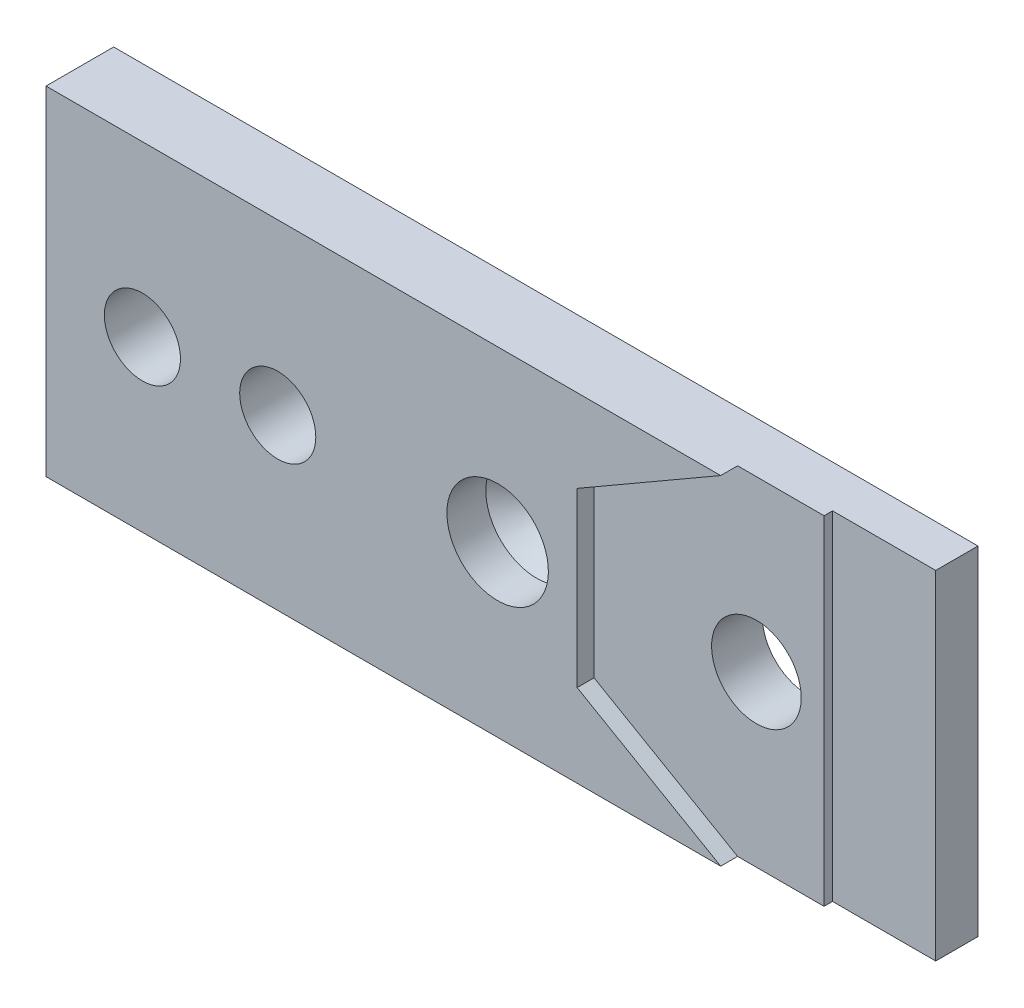
from build123d import *

# Parameters (mm, degrees)
AUFSATZ_LINEAR_AUSTRAGEN1_DEPTH    = 20
SKIZZE2_R                          = 1.6499999999999988
SKIZZE2_R_2                        = 2.65
SKIZZE2_R_3                        = 2.250000000000001
SCHNITT_LINEAR_AUSTRAGEN1_DEPTH    = 3
SKIZZE3_R                          = 2.250000000000001
SKIZZE3_R_2                        = 1.6499999999999988
AUFSATZ_LINEAR_AUSTRAGEN2_DEPTH    = 1
SKIZZE5_W                          = 1.9999999999999998
SKIZZE5_H                          = 2
SCHNITT_LINEAR_AUSTRAGEN2_DEPTH    = 1
K_RPER_VERSCHIEBEN_KOPIEREN1_ANGLE = 90.00000000007478


with BuildPart() as part:
    # Skizze1 → Aufsatz-Linear austragen1 (new body)
    with BuildSketch(Plane.XY):
        Polygon((0, 0), (51.099999999999994, 0), (51.1, 2.5), (45, 2.499999999999999), (45, 3.0000000000000058), (6e-16, 3), align=None)
    extrude(amount=AUFSATZ_LINEAR_AUSTRAGEN1_DEPTH)

    # Skizze2 → Schnitt-Linear austragen1 (cut)
    with BuildSketch(Plane.XZ):
        with Locations(Location((26.699999999999996, 9.999999999999998, 0), (0, 0, 270))):
            Circle(SKIZZE2_R)
        with Locations(Location((40.99999999999999, 10, 0), (0, 0, 270))):
            Circle(SKIZZE2_R_2)
        with Locations(Location((13.699999999999996, 10, 0), (0, 0, 270))):
            Circle(SKIZZE2_R_3)
        with Locations(Location((5.699999999999995, 9.999999999999998, 0), (0, 0, 270))):
            Circle(SKIZZE2_R_3)
    extrude(amount=-SCHNITT_LINEAR_AUSTRAGEN1_DEPTH, mode=Mode.SUBTRACT)

    # Skizze3 → Aufsatz-Linear austragen2 (add)
    with BuildSketch(Plane(origin=(-3.8e-16, 3, 0), x_dir=(1, 1.2e-16, 0), z_dir=(-1.2e-16, 1, 0))):
        Polygon((39.887048957087536, 0), (9.5e-16, 0), (9.5e-16, -8), (-1.9999999999999987, -8), (-1.9999999999999987, -10), (9.5e-16, -10), (9.5e-16, -20), (39.887048957087536, -19.99999999999999), (31.39999999999999, -15.1), (31.39999999999999, -4.900000000000001), align=None)
        with Locations((5.699999999999995, -9.999999999999998)):
            Circle(SKIZZE3_R, mode=Mode.SUBTRACT)
        with Locations((13.699999999999996, -10)):
            Circle(SKIZZE3_R, mode=Mode.SUBTRACT)
        with Locations((26.699999999999996, -9.999999999999998)):
            Circle(SKIZZE3_R_2, mode=Mode.SUBTRACT)
    extrude(amount=AUFSATZ_LINEAR_AUSTRAGEN2_DEPTH)

    # Skizze4 → Schnitt-Rotation3 (revolve, cut)
    with BuildSketch(Plane.XY.offset(10), mode=Mode.PRIVATE) as schnitt_rotation3_sk:
        Polygon((23.699999999999996, 3.9999999999999964), (23.699999999999996, 1.699999999999991), (25.199999999999992, 0.2), (26.699999999999996, 0.2000000000000001), (26.699999999999996, 3.9999999999999964), align=None)
    revolve(schnitt_rotation3_sk.sketch.rotate(Axis((26.699999999999996, 0.2000000000000001, 10), (0, 1, 0)), 270), axis=Axis((26.699999999999996, 0.2000000000000001, 10), (0, 1, 0)), mode=Mode.SUBTRACT)

    # Skizze5 → Schnitt-Linear austragen2 (cut)
    with BuildSketch(Plane(origin=(0, 4, 0), x_dir=(1, 0, 0), z_dir=(0, 1, 0))):
        with Locations((-1, -9)):
            Rectangle(SKIZZE5_W, SKIZZE5_H)
    extrude(amount=-SCHNITT_LINEAR_AUSTRAGEN2_DEPTH, mode=Mode.SUBTRACT)


with BuildPart() as part_1:
    # Körper-Verschieben/Kopieren1: moved
    add(part.part.rotate(Axis((0, 1.500000000000004, 9.999999999999998), (1, 0, 0)), K_RPER_VERSCHIEBEN_KOPIEREN1_ANGLE))


solid = part_1.part
